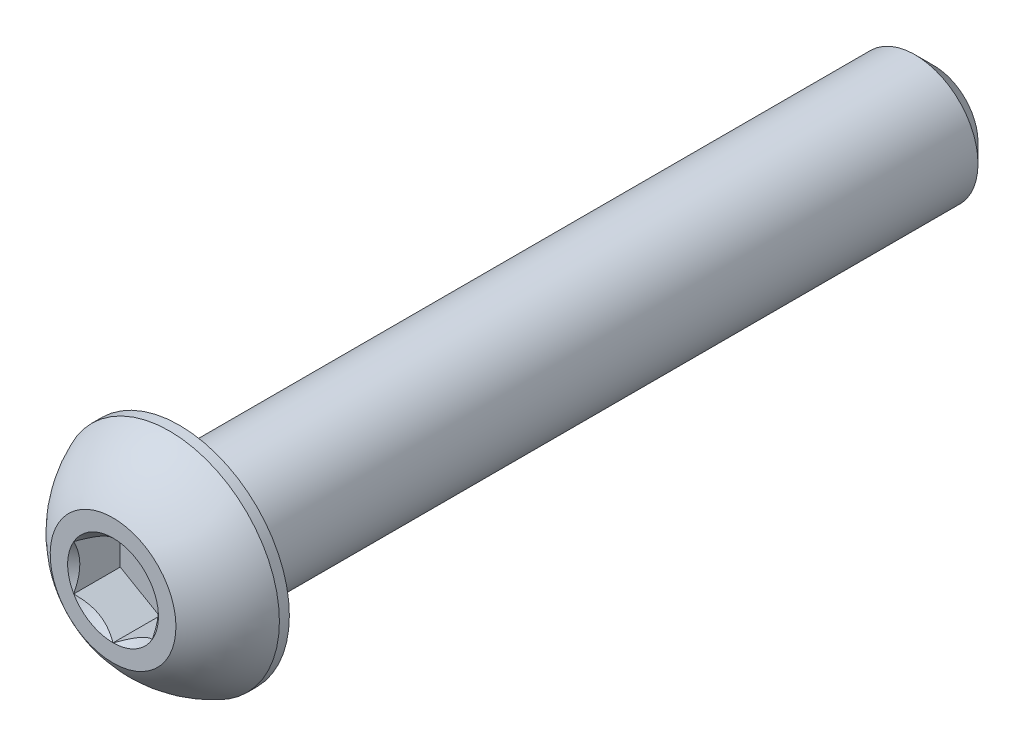
from build123d import *

# Parameters (mm, degrees)
SKETCH1_W          = 38.1
SKETCH1_H          = 3.175
CHAMFER1_SIZE      = 0.9525
CUT_EXTRUDE2_DEPTH = 2.34696


with BuildPart() as part:
    # Sketch1 → Revolve1 (revolve)
    with BuildSketch(Plane(origin=(0, 0, 0), x_dir=(0, 0, -1), z_dir=(1, 0, 0))):
        with Locations((22.4028, 1.5875)):
            Rectangle(SKETCH1_W, SKETCH1_H)
    revolve(axis=Axis((0, 0, -41.4528), (0, 0, 1)))

    # Chamfer1
    chamfer1_edges = [part.edges().sort_by_distance(p)[0] for p in [
        (0, -3.175, -41.4528),
    ]]
    chamfer(chamfer1_edges, length=CHAMFER1_SIZE)

    # Sketch7 → Revolve2 (revolve)
    with BuildSketch(Plane(origin=(0, 0, 0), x_dir=(0, 0, -1), z_dir=(1, 0, 0))):
        with BuildLine():
            Line((2.84988, 5.5499), (3.3528, 5.5499))
            Line((3.3528, 5.5499), (3.3528, 0))
            Line((3.3528, 0), (0, 0))
            Line((0, 0), (0, 3.175))
            ThreePointArc((0, 3.175), (1.235921075, 4.58927271), (2.84988, 5.5499))
        make_face()
    revolve(axis=Axis((0, 0, 0), (0, 0, -1)))

    # Sketch5 → Cut-Extrude2 (cut)
    with BuildSketch(Plane.XY):
        Polygon((1.984375, -1.14567944), (1.984375, 1.14567944), (0, 2.291358881), (-1.984375, 1.14567944), (-1.984375, -1.14567944), (0, -2.291358881), align=None)
    extrude(amount=-CUT_EXTRUDE2_DEPTH, mode=Mode.SUBTRACT)

    # Cut-Extrude3 cone 1 section (through the dimple's axis) → Cut-Extrude3 (revolve, cut)
    with BuildSketch(Plane(origin=(0, 0, 0), x_dir=(0, -1, 0), z_dir=(1, 0, 0))):
        Polygon((0, 0), (2.291358881, 0), (0, 2.291358881), align=None)
    revolve(axis=Axis((0, 0, 0), (0, 0, -1)), mode=Mode.SUBTRACT)


solid = part.part
